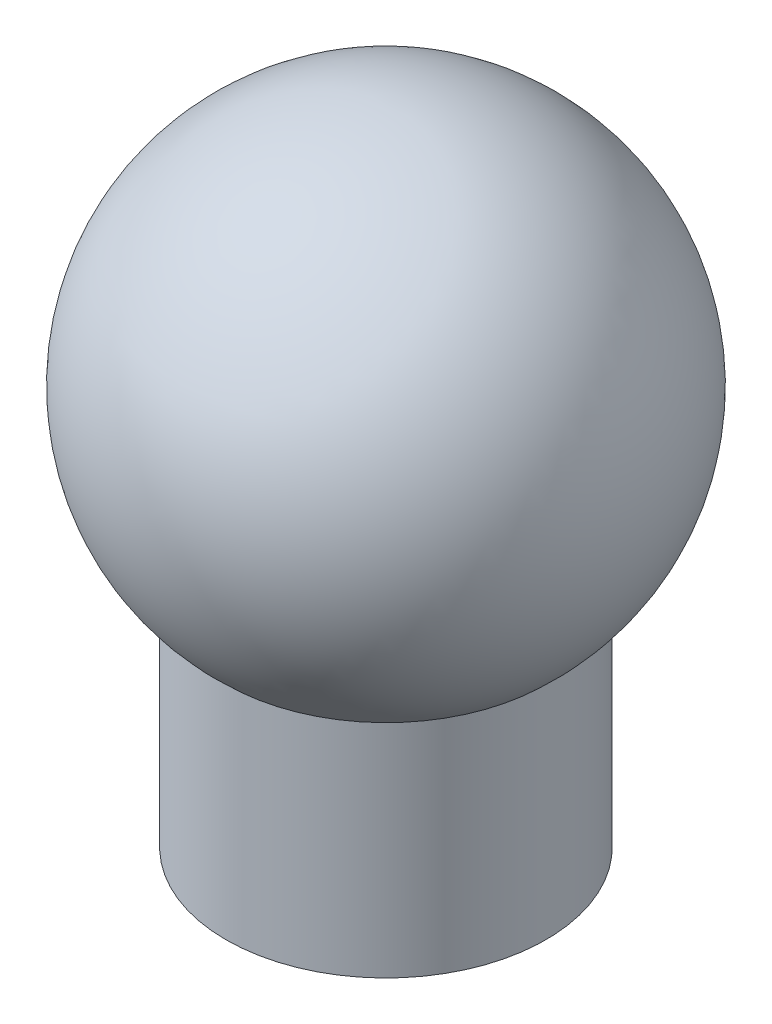
from build123d import *

# Parameters (mm, degrees)
BOSS_EXTRUDE1_REACH      = 52.706
BOSS_EXTRUDE1_END_RADIUS = 12
BOSS_EXTRUDE1_START      = 5
SKETCH3_R                = 8
SKETCH4_R                = 6
CUT_EXTRUDE2_DEPTH       = 2
SKETCH5_R                = 5
CUT_EXTRUDE3_DEPTH       = 5


with BuildPart() as part:
    # Sketch2 → Revolve1 (revolve)
    with BuildSketch(Plane(origin=(0, 0, 0), x_dir=(1, 0, 0), z_dir=(0, 1, 0))):
        with BuildLine():
            Line((0, 0), (24, 0))
            ThreePointArc((24, 0), (12, 12), (0, 0))
        make_face()
    revolve(axis=Axis((0, 0, 0), (1, 0, 0)))

    # Boss-Extrude1: up to this sphere (the profile starts outside it)
    boss_extrude1_end = Location((12, 0, 0)) * Sphere(BOSS_EXTRUDE1_END_RADIUS, mode=Mode.PRIVATE)
    # Sketch3 → Boss-Extrude1 (add, up to the surface)
    with BuildSketch(Plane(origin=(0, -25, 0), x_dir=(1, 0, 0), z_dir=(0, 1, 0)).offset(BOSS_EXTRUDE1_START), mode=Mode.PRIVATE) as boss_extrude1_sk1:
        with Locations(Location((12, 0, 0), (0, 0, 270))):
            Circle(SKETCH3_R)
    boss_extrude1_tool1 = extrude(boss_extrude1_sk1.sketch, amount=BOSS_EXTRUDE1_REACH, mode=Mode.PRIVATE) - boss_extrude1_end
    add(boss_extrude1_tool1.solids().sort_by_distance((12, -20, 0))[0])

    # Sketch4 → Cut-Extrude2 (cut)
    with BuildSketch(Plane.XZ.offset(20)):
        with Locations(Location((12, 0, 0), (0, 0, 270))):
            Circle(SKETCH4_R)
    extrude(amount=-CUT_EXTRUDE2_DEPTH, mode=Mode.SUBTRACT)

    # Sketch5 → Cut-Extrude3 (cut)
    with BuildSketch(Plane.XZ.offset(18)):
        with Locations(Location((12, 0, 0), (0, 0, 270))):
            Circle(SKETCH5_R)
    extrude(amount=-CUT_EXTRUDE3_DEPTH, mode=Mode.SUBTRACT)


solid = part.part
